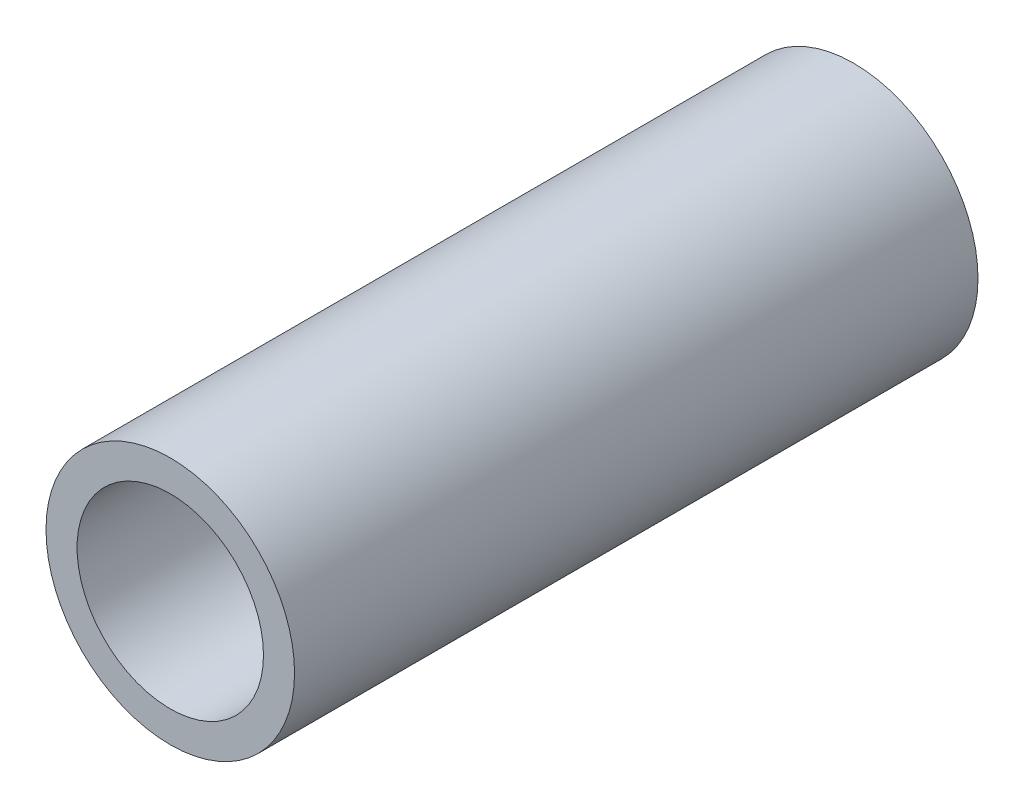
from build123d import *

# Parameters (mm, degrees)
SKETCH1_R           = 4
SKETCH1_R_2         = 3
EXTRUDE_THIN1_DEPTH = 22


with BuildPart() as part:
    # Sketch1 → Extrude-Thin1 (new body)
    with BuildSketch(Plane.XY):
        Circle(SKETCH1_R)
        Circle(SKETCH1_R_2, mode=Mode.SUBTRACT)
    extrude(amount=EXTRUDE_THIN1_DEPTH)


solid = part.part
